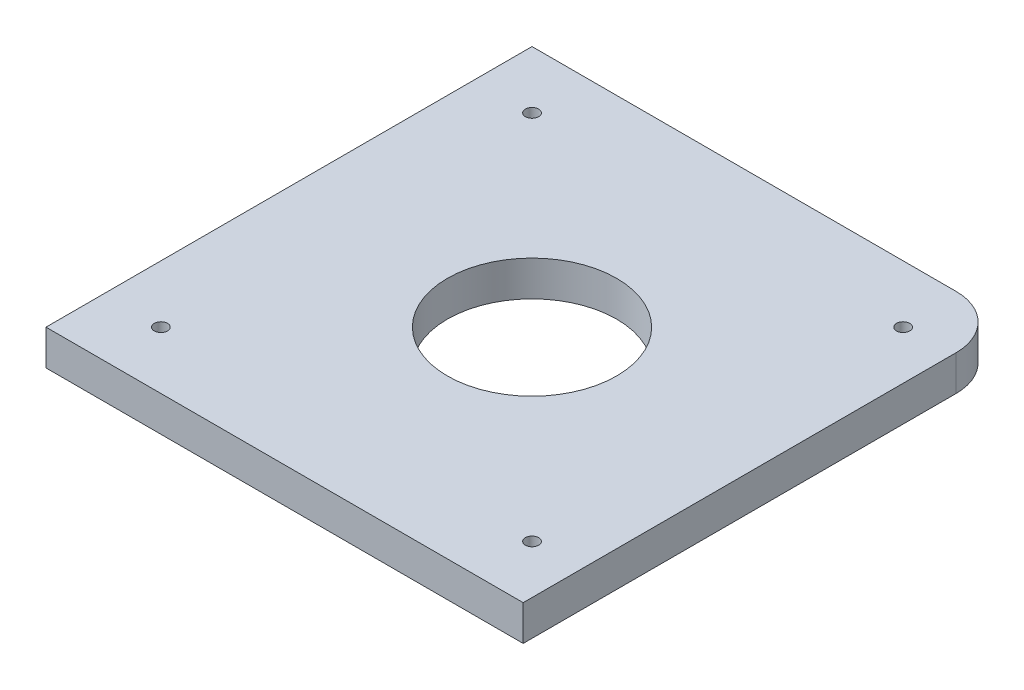
from build123d import *

# Parameters (mm, degrees)
SKETCH1_W           = 108
SKETCH1_H           = 110
SKETCH1_R           = 19.15
SKETCH1_R_2         = 1.5
BOSS_EXTRUDE1_DEPTH = 8
FILLET1_R           = 12


with BuildPart() as part:
    # Sketch1 → Boss-Extrude1 (new body)
    with BuildSketch(Plane(origin=(0, 0, 0), x_dir=(1, 0, 0), z_dir=(0, 1, 0))):
        with Locations((-1, 0)):
            Rectangle(SKETCH1_W, SKETCH1_H)
        with Locations(Location((0, 0, 0), (0, 0, 270))):
            Circle(SKETCH1_R, mode=Mode.SUBTRACT)
        with Locations(Location((-42, 42, 0), (0, 0, 270))):
            Circle(SKETCH1_R_2, mode=Mode.SUBTRACT)
        with Locations(Location((42, 42, 0), (0, 0, 270))):
            Circle(SKETCH1_R_2, mode=Mode.SUBTRACT)
        with Locations(Location((42, -42, 0), (0, 0, 270))):
            Circle(SKETCH1_R_2, mode=Mode.SUBTRACT)
        with Locations(Location((-42, -42, 0), (0, 0, 270))):
            Circle(SKETCH1_R_2, mode=Mode.SUBTRACT)
    extrude(amount=BOSS_EXTRUDE1_DEPTH)

    # Fillet1
    fillet1_edges = [part.edges().sort_by_distance(p)[0] for p in [
        (53, 4, -55),
    ]]
    fillet(fillet1_edges, radius=FILLET1_R)


solid = part.part
